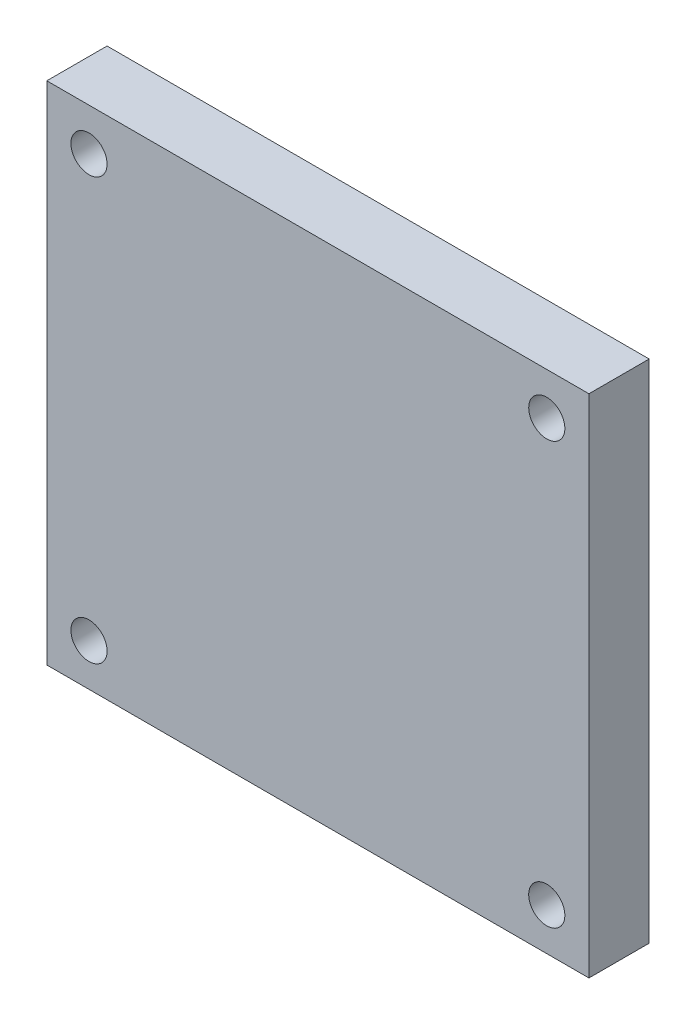
from build123d import *

# Parameters (mm, degrees)
SKETCH_1_W      = 45
SKETCH_1_H      = 42
SKETCH_1_R      = 1.5
EXTRUDE_1_DEPTH = 5


with BuildPart() as part:
    # 草图1 → 凸台-拉伸1 (new body)
    with BuildSketch(Plane.XY):
        with Locations((-22.5, 21)):
            Rectangle(SKETCH_1_W, SKETCH_1_H)
        with Locations((-3.5, 3.5)):
            Circle(SKETCH_1_R, mode=Mode.SUBTRACT)
        with Locations(Location((-41.5, 3.5, 0), (0, 0, 180))):
            Circle(SKETCH_1_R, mode=Mode.SUBTRACT)
        with Locations(Location((-3.5, 38.5, 0), (0, 0, 180))):
            Circle(SKETCH_1_R, mode=Mode.SUBTRACT)
        with Locations((-41.5, 38.5)):
            Circle(SKETCH_1_R, mode=Mode.SUBTRACT)
    extrude(amount=EXTRUDE_1_DEPTH)


solid = part.part
